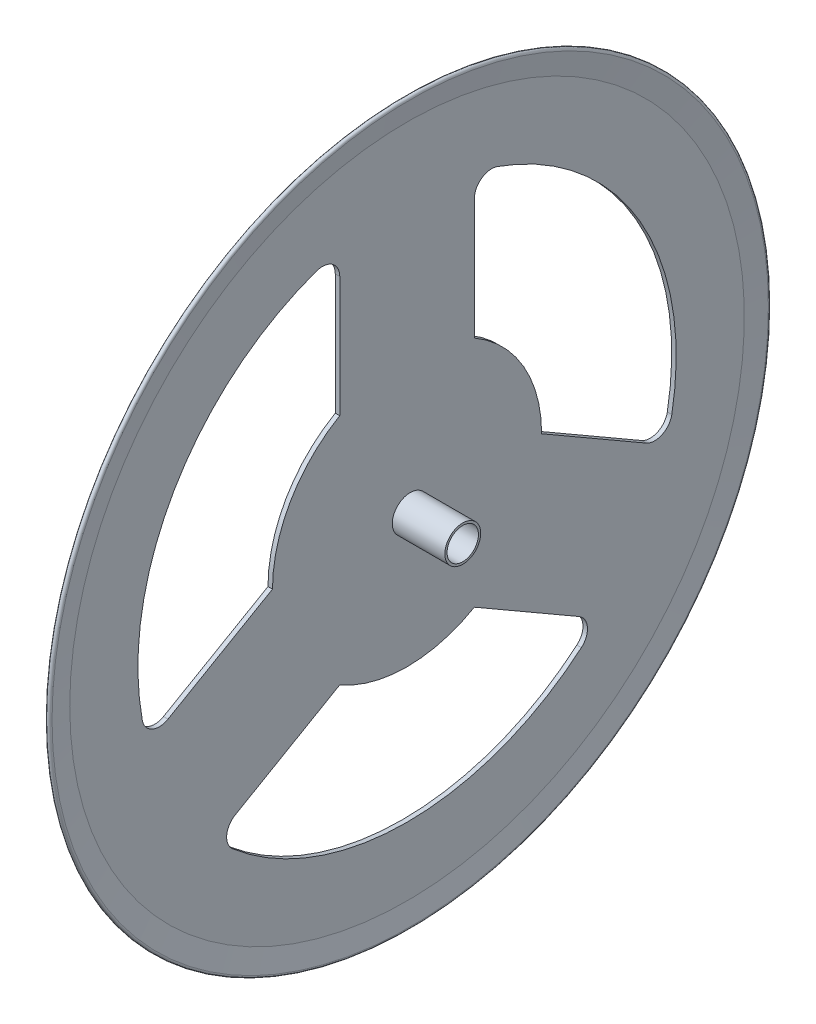
from build123d import *

# Parameters (mm, degrees)
CUT_EXTRUDE1_DEPTH = 114.74253479
SKETCH5_R          = 3.5
CUT_EXTRUDE2_DEPTH = 8


with BuildPart() as part:
    # Sketch1 → Revolve1 (revolve)
    with BuildSketch(Plane.XY, mode=Mode.PRIVATE) as revolve1_sk:
        with BuildLine():
            Line((-22.400929177, 0), (-22.400929177, 75.270674012))
            Line((-22.400929177, 75.270674012), (-21.683501684, 80))
            ThreePointArc((-21.683501684, 80), (-21.114166433, 80.419353518), (-20.694812916, 79.850018268))
            Line((-20.694812916, 79.850018268), (-21.400929177, 75.195256614))
            Line((-21.400929177, 75.195256614), (-21.400929177, 0))
            Line((-21.400929177, 0), (-22.400929177, 0))
        make_face()
    revolve(revolve1_sk.sketch.rotate(Axis((-22.400929177, 0, 0), (1, 0, 0)), 90), axis=Axis((-22.400929177, 0, 0), (1, 0, 0)))

    # Sketch2 → Cut-Extrude1 (cut, through all)
    with BuildSketch(Plane(origin=(-21.400929177, 0, 0), x_dir=(0, 0, -1), z_dir=(1, 0, 0))):
        with BuildLine():
            Line((-15, 25.980762114), (-15, 52.870468111))
            ThreePointArc((-15, 52.870468111), (-16.638004811, 56.029253081), (-20.163544097, 56.510454692))
            ThreePointArc((-20.163544097, 56.510454692), (-51.961524227, 30), (-59.021261391, -10.793085928))
            ThreePointArc((-59.021261391, -10.793085928), (-56.841758929, -13.605691706), (-53.287168494, -13.444852999))
            Line((-53.287168494, -13.444852999), (-30, 0))
            ThreePointArc((-30, 0), (-25.980762114, 15), (-15, 25.980762114))
        make_face()
        with BuildLine():
            ThreePointArc((15, -25.980762114), (0, -30), (-15, -25.980762114))
            Line((-15, -25.980762114), (-38.287168494, -39.425615112))
            ThreePointArc((-38.287168494, -39.425615112), (-40.203754118, -42.423561375), (-38.857717294, -45.717368764))
            ThreePointArc((-38.857717294, -45.717368764), (0, -60), (38.857717294, -45.717368764))
            ThreePointArc((38.857717294, -45.717368764), (40.203754118, -42.423561375), (38.287168494, -39.425615112))
            Line((38.287168494, -39.425615112), (15, -25.980762114))
        make_face()
        with BuildLine():
            Line((15, 52.870468111), (15, 25.980762114))
            ThreePointArc((15, 25.980762114), (25.980762114, 15), (30, 0))
            Line((30, 0), (53.287168494, -13.444852999))
            ThreePointArc((53.287168494, -13.444852999), (56.841758929, -13.605691706), (59.021261391, -10.793085928))
            ThreePointArc((59.021261391, -10.793085928), (51.961524227, 30), (20.163544097, 56.510454692))
            ThreePointArc((20.163544097, 56.510454692), (16.638004811, 56.029253081), (15, 52.870468111))
        make_face()
    extrude(amount=-CUT_EXTRUDE1_DEPTH, mode=Mode.SUBTRACT)


with BuildPart() as body_2:
    # Sketch4 → Revolve2 (revolve)
    with BuildSketch(Plane.XY, mode=Mode.PRIVATE) as revolve2_sk:
        Polygon((-18.982708488, 4), (-8.982708488, 4), (-8.982708488, 0), (-20.694812916, 0), (-20.694812916, 4), align=None)
    revolve(revolve2_sk.sketch.rotate(Axis((-20.694812916, 0, 0), (1, 0, 0)), 90), axis=Axis((-20.694812916, 0, 0), (1, 0, 0)))

    # Sketch5 → Cut-Extrude2 (cut)
    with BuildSketch(Plane(origin=(-8.982708488, 0, 0), x_dir=(0, 0, -1), z_dir=(1, 0, 0))):
        Circle(SKETCH5_R)
    extrude(amount=-CUT_EXTRUDE2_DEPTH, mode=Mode.SUBTRACT)


solid = Compound([part.part, body_2.part])
